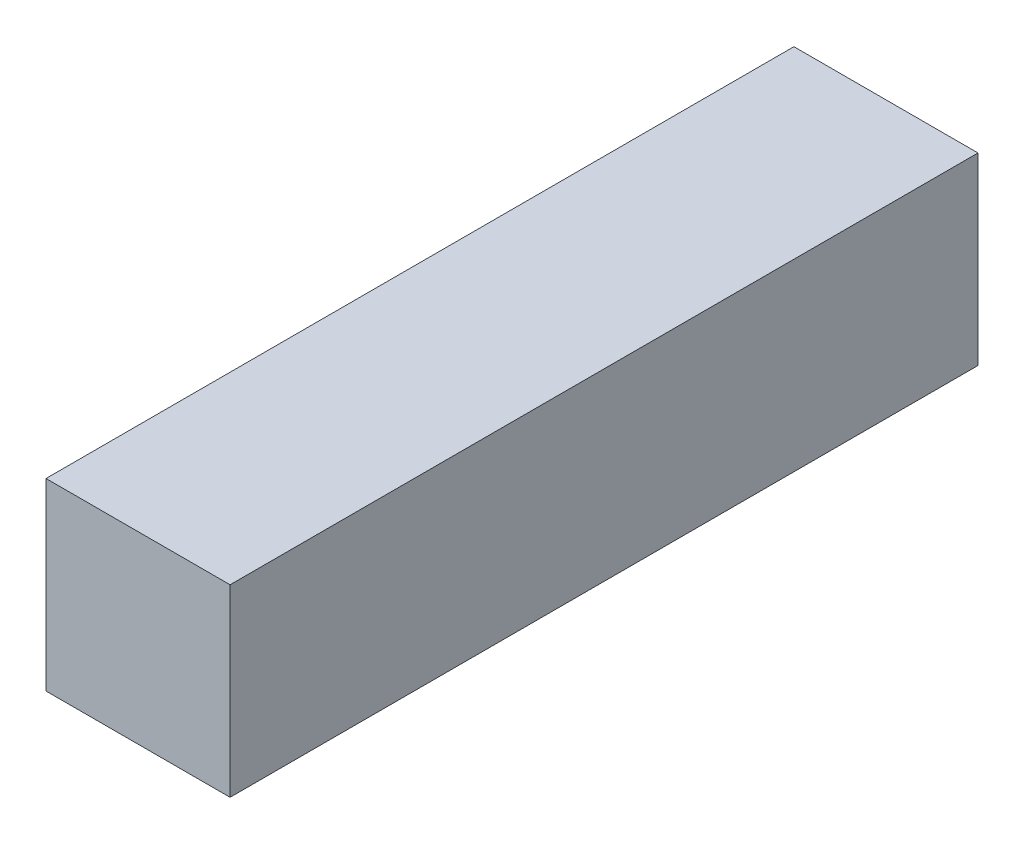
from build123d import *

# Parameters (mm, degrees)
SKETCH1_W           = 4.92
SKETCH1_H           = 4.92
BOSS_EXTRUDE1_DEPTH = 19.99


with BuildPart() as part:
    # Sketch1 → Boss-Extrude1 (new body)
    with BuildSketch(Plane.XY):
        Rectangle(SKETCH1_W, SKETCH1_H)
    extrude(amount=BOSS_EXTRUDE1_DEPTH)


solid = part.part
